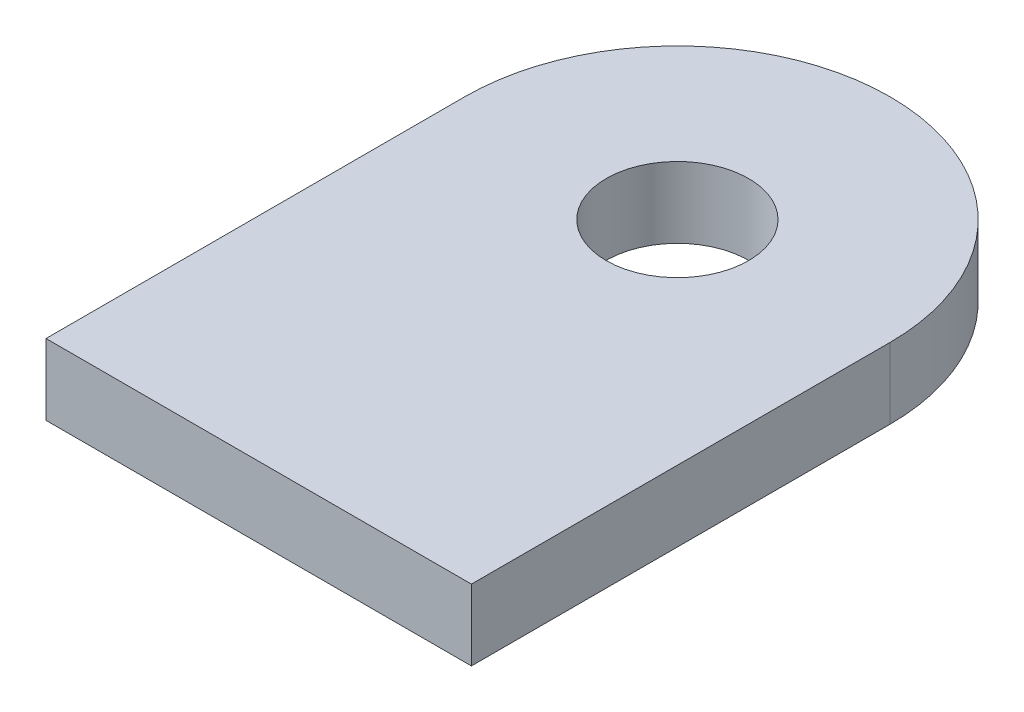
from build123d import *

# Parameters (mm, degrees)
SKETCH1_R           = 4.25
BOSS_EXTRUDE1_DEPTH = 4.233333333


with BuildPart() as part:
    # Sketch1 → Boss-Extrude1 (new body)
    with BuildSketch(Plane(origin=(0, 0, 0), x_dir=(1, 0, 0), z_dir=(0, 1, 0))):
        with BuildLine():
            Line((0, 0), (25.4, 0))
            Line((25.4, 0), (25.4, 25))
            ThreePointArc((25.4, 25), (12.7, 37.7), (0, 25))
            Line((0, 25), (0, 0))
        make_face()
        with Locations(Location((12.7, 25, 0), (0, 0, 270))):
            Circle(SKETCH1_R, mode=Mode.SUBTRACT)
    extrude(amount=BOSS_EXTRUDE1_DEPTH)


solid = part.part
